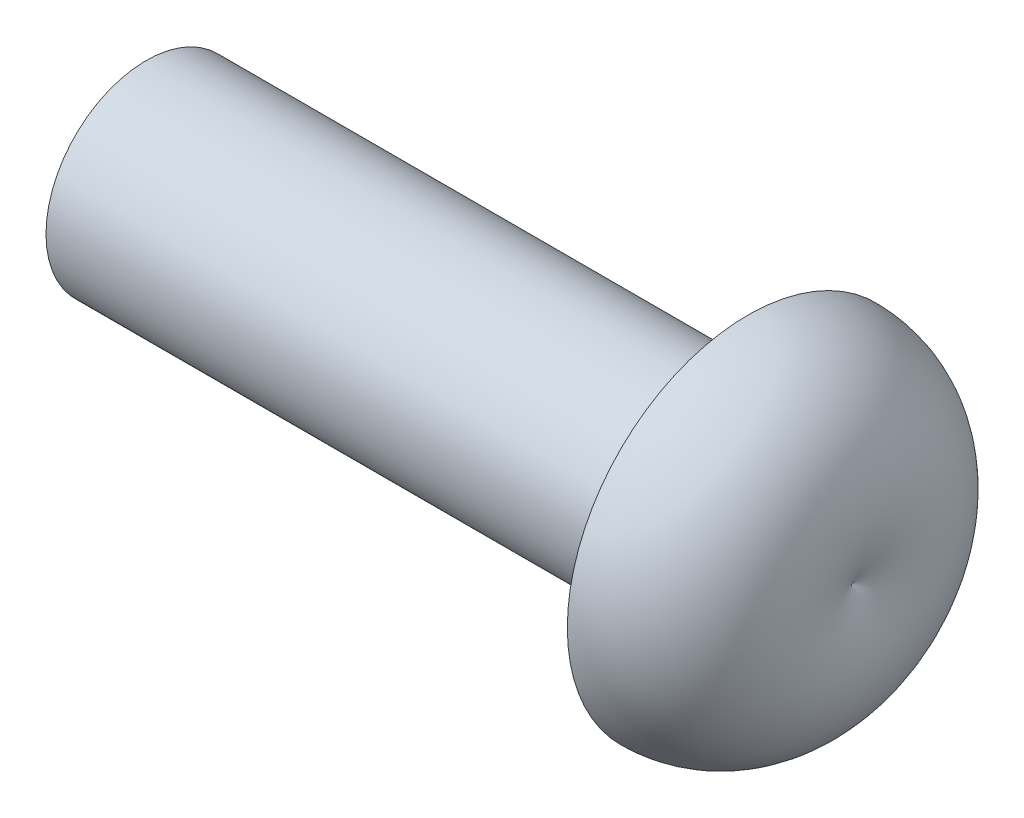
from build123d import *


with BuildPart() as part:
    # 草图1 → 旋转1 (revolve)
    with BuildSketch(Plane.XY, mode=Mode.PRIVATE) as revolve_1_sk:
        with BuildLine():
            Line((-15, 0), (0, 0))
            Line((0, 0), (0, 2))
            ThreePointArc((0, 2), (2.598076211, 0.5), (2.598076211, -2.5))
            Line((2.598076211, -2.5), (-15, -2.5))
            Line((-15, -2.5), (-15, 0))
        make_face()
    revolve(revolve_1_sk.sketch.rotate(Axis((-16.386916736, -2.5, 0), (1, 0, 0)), 90), axis=Axis((-16.386916736, -2.5, 0), (1, 0, 0)))


solid = part.part
